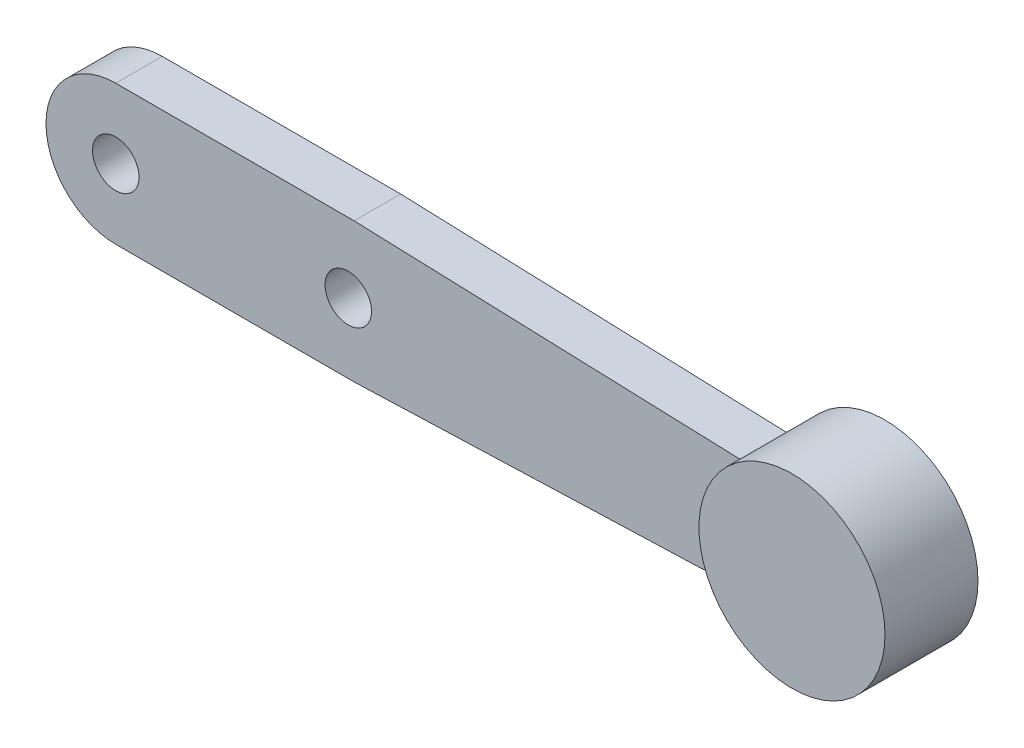
from build123d import *

# Parameters (mm, degrees)
BOSS_EXTRUDE1_DEPTH = 2.5
SKETCH2_R           = 10
BOSS_EXTRUDE2_DEPTH = 5


with BuildPart() as part:
    # Sketch1 → Boss-Extrude1 (new, symmetric)
    with BuildSketch(Plane.XY):
        with BuildLine():
            ThreePointArc((-17.5, 0.005872539), (-19.696699141, 5.309173398), (-25, 7.505872539))
            Line((-25, 7.505872539), (-25, 2.505872539))
            ThreePointArc((-25, 2.505872539), (-23.232233047, 1.773639492), (-22.5, 0.005872539))
            Line((-22.5, 0.005872539), (-17.5, 0.005872539))
        make_face()
        with BuildLine():
            Line((-25, 2.505872539), (-25, 7.505872539))
            ThreePointArc((-25, 7.505872539), (-30.303300859, 5.309173398), (-32.5, 0.005872539))
            Line((-32.5, 0.005872539), (-27.5, 0.005872539))
            ThreePointArc((-27.5, 0.005872539), (-26.767766953, 1.773639492), (-25, 2.505872539))
        make_face()
        with BuildLine():
            ThreePointArc((-25, -7.494127461), (-19.696699141, -5.29742832), (-17.5, 0.005872539))
            Line((-17.5, 0.005872539), (-22.5, 0.005872539))
            ThreePointArc((-22.5, 0.005872539), (-23.232233047, -1.761894414), (-25, -2.494127461))
            Line((-25, -2.494127461), (-25, -7.494127461))
        make_face()
        with BuildLine():
            Line((-27.5, 0.005872539), (-32.5, 0.005872539))
            ThreePointArc((-32.5, 0.005872539), (-30.303300859, -5.29742832), (-25, -7.494127461))
            Line((-25, -7.494127461), (-25, -2.494127461))
            ThreePointArc((-25, -2.494127461), (-26.767766953, -1.761894414), (-27.5, 0.005872539))
        make_face()
        with BuildLine():
            ThreePointArc((50.201457579, -5.763117708), (54.152393819, -4.00404756), (55.772506702, 0.005872539))
            Line((55.772506702, 0.005872539), (2.499993103, 0.005872539))
            ThreePointArc((2.499993103, 0.005872539), (2.499998276, 0.002936272), (2.5, 0))
            ThreePointArc((2.5, 0), (1.869738707, -1.659541253), (0.296738265, -2.482326812))
            ThreePointArc((0.296738265, -2.482326812), (-1.661736132, -1.867788272), (-2.499993103, 0.005872539))
            Line((-2.499993103, 0.005872539), (-17.5, 0.005872539))
            ThreePointArc((-17.5, 0.005872539), (-19.696699141, -5.29742832), (-25, -7.494127461))
            Line((-25, -7.494127461), (0.631823856, -7.494127461))
            Line((0.631823856, -7.494127461), (50.201457579, -5.763117708))
        make_face()
        with BuildLine():
            Line((50.201457579, 5.774862786), (0.631823856, 7.505872539))
            Line((0.631823856, 7.505872539), (-25, 7.505872539))
            ThreePointArc((-25, 7.505872539), (-19.696699141, 5.309173398), (-17.5, 0.005872539))
            Line((-17.5, 0.005872539), (-2.499993103, 0.005872539))
            ThreePointArc((-2.499993103, 0.005872539), (-1.657344084, 1.871686562), (0.296738265, 2.482326812))
            ThreePointArc((0.296738265, 2.482326812), (1.867788272, 1.661736132), (2.499993103, 0.005872539))
            Line((2.499993103, 0.005872539), (55.772506702, 0.005872539))
            ThreePointArc((55.772506702, 0.005872539), (54.152393819, 4.015792638), (50.201457579, 5.774862786))
        make_face()
    extrude(amount=BOSS_EXTRUDE1_DEPTH, both=True)

    # Sketch2 → Boss-Extrude2 (add, symmetric)
    with BuildSketch(Plane.XY):
        with Locations((50.201457579, 0.005872539)):
            Circle(SKETCH2_R)
    extrude(amount=BOSS_EXTRUDE2_DEPTH, both=True)


solid = part.part
